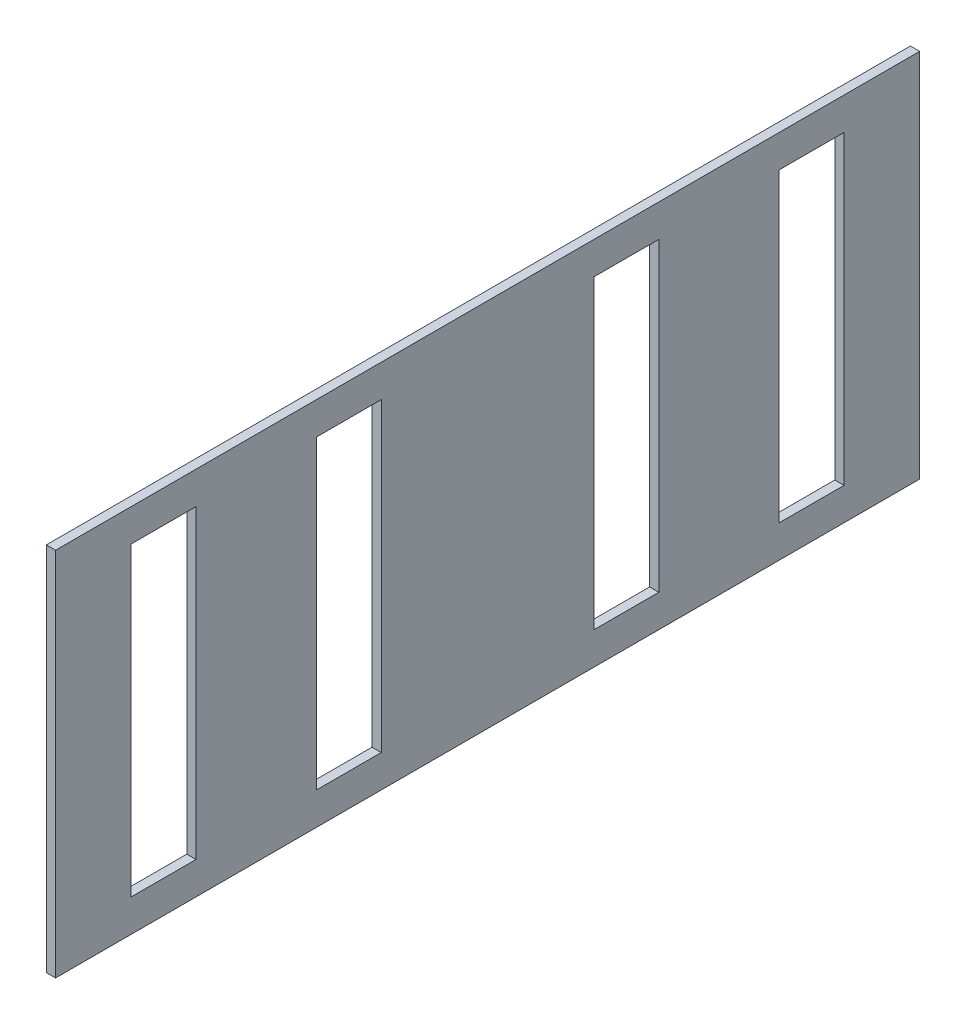
from build123d import *

# Parameters (mm, degrees)
SKETCH1_W           = 236.982
SKETCH1_H           = 101.6
SKETCH1_W_2         = 17.78
SKETCH1_H_2         = 83.82
BOSS_EXTRUDE1_DEPTH = 2.54


with BuildPart() as part:
    # Sketch1 → Boss-Extrude1 (new body)
    with BuildSketch(Plane(origin=(0, 0, 0), x_dir=(0, 0, -1), z_dir=(1, 0, 0))):
        Rectangle(SKETCH1_W, SKETCH1_H)
        with Locations((88.865075, 0)):
            Rectangle(SKETCH1_W_2, SKETCH1_H_2, mode=Mode.SUBTRACT)
        with Locations((38.065075, 0)):
            Rectangle(SKETCH1_W_2, SKETCH1_H_2, mode=Mode.SUBTRACT)
        with Locations((-88.865075, 0)):
            Rectangle(SKETCH1_W_2, SKETCH1_H_2, mode=Mode.SUBTRACT)
        with Locations((-38.065075, 0)):
            Rectangle(SKETCH1_W_2, SKETCH1_H_2, mode=Mode.SUBTRACT)
    extrude(amount=BOSS_EXTRUDE1_DEPTH)


solid = part.part
